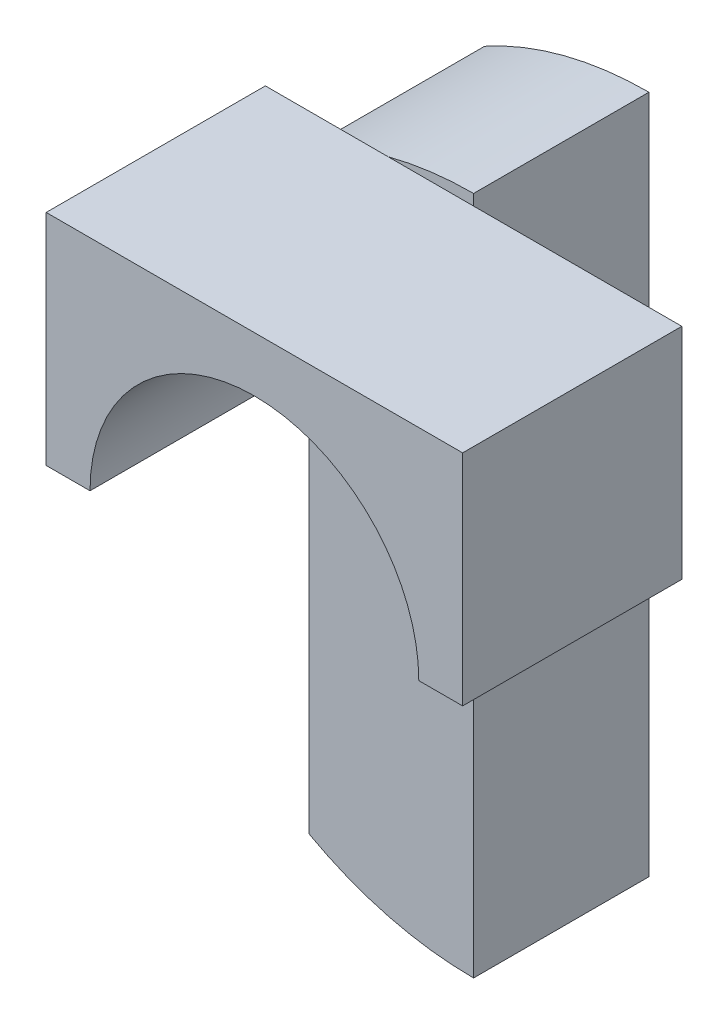
from build123d import *

# Parameters (mm, degrees)
EXTRUDE_1_DEPTH = 8
EXTRUDE_2_DEPTH = 10


with BuildPart() as part:
    # 草图1 → 凸台-拉伸1 (new body)
    with BuildSketch(Plane.XY):
        with BuildLine():
            Line((0, 15.5), (0, -15.5))
            ThreePointArc((0, -15.5), (-3.872839431, -15.008368157), (-7.5, -13.564659966))
            Line((-7.5, -13.564659966), (-7.5, 13.564659966))
            ThreePointArc((-7.5, 13.564659966), (-3.872839431, 15.008368157), (0, 15.5))
        make_face()
    extrude(amount=EXTRUDE_1_DEPTH)

    # 草图2 → 凸台-拉伸2 (add)
    with BuildSketch(Plane.XY.offset(8)):
        with BuildLine():
            Line((7.5, 5), (9.5, 5))
            Line((9.5, 5), (9.5, 15))
            Line((9.5, 15), (-9.5, 15))
            Line((-9.5, 15), (-9.5, 5))
            Line((-9.5, 5), (-7.5, 5))
            ThreePointArc((-7.5, 5), (0, 12.5), (7.5, 5))
        make_face()
    extrude(amount=EXTRUDE_2_DEPTH)


solid = part.part
